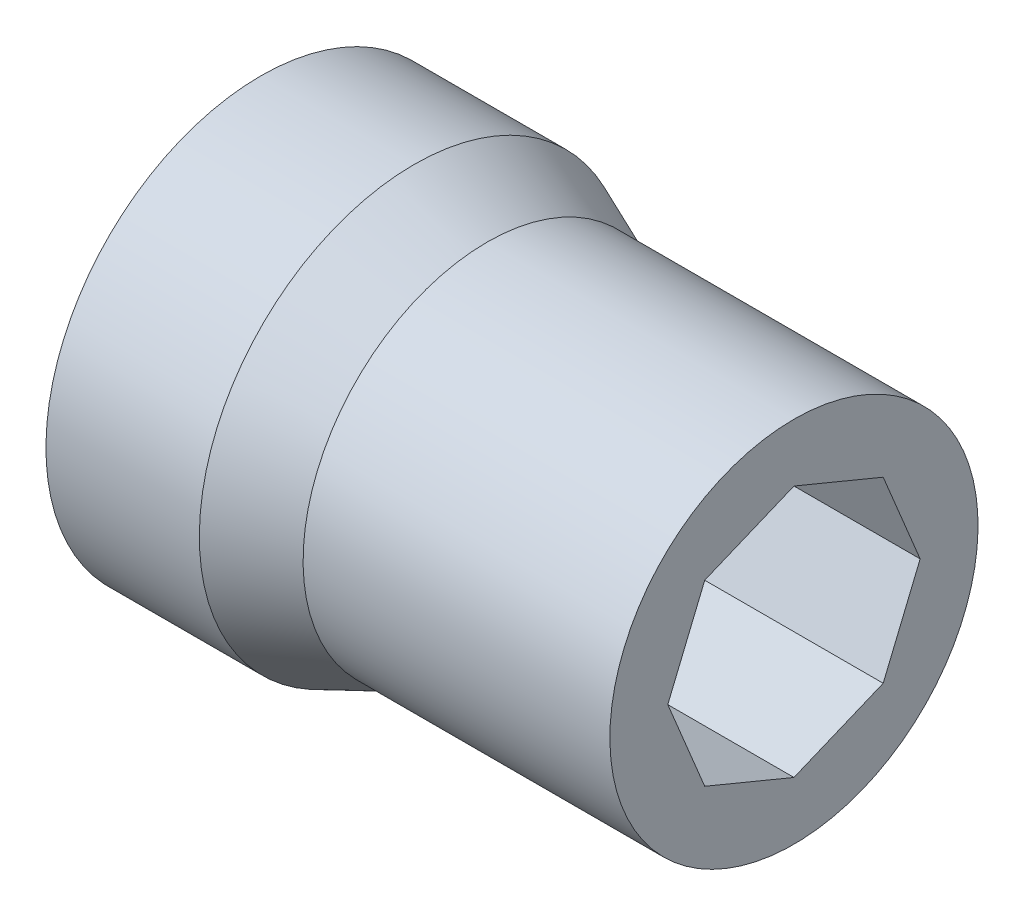
from build123d import *

# Parameters (mm, degrees)
CUT_EXTRUDE2_DEPTH = 4


with BuildPart() as part:
    # Sketch4 → Revolve4 (revolve)
    with BuildSketch(Plane.XY):
        Polygon((-5, 0), (0, 0), (3.690598923, 0), (3.690598923, 3), (0, 3), (-1.309401077, 3), (-2.5, 3.5), (-5, 3.5), align=None)
    revolve(axis=Axis((0, 0, 0), (-1, 0, 0)))

    # Sketch6 → Cut-Extrude2 (cut)
    with BuildSketch(Plane(origin=(3.690598923, 0, 0), x_dir=(0, 0, -1), z_dir=(1, 0, 0))):
        Polygon((-2.056545181, 0), (-1.454197043, -1.454197043), (0, -2.056545181), (1.454197043, -1.454197043), (2.056545181, 0), (1.454197043, 1.454197043), (0, 2.056545181), (-1.454197043, 1.454197043), align=None)
    extrude(amount=-CUT_EXTRUDE2_DEPTH, mode=Mode.SUBTRACT)


solid = part.part
